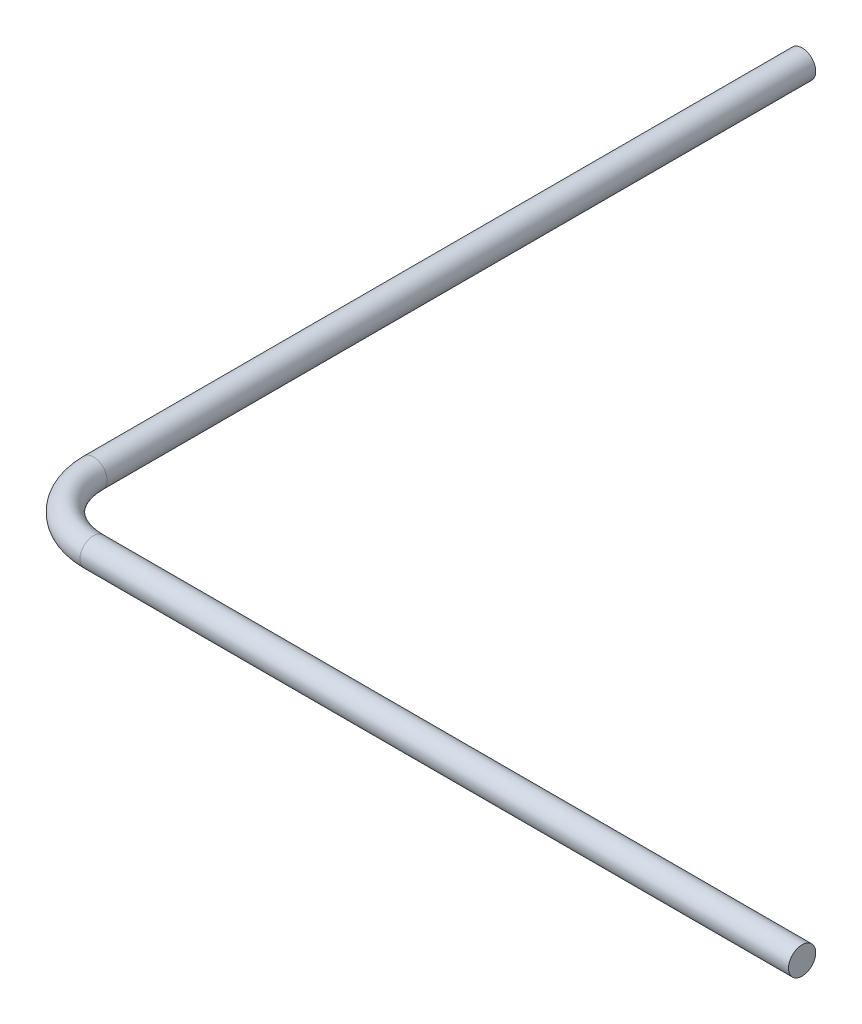
from build123d import *

# Parameters (mm, degrees)
SKETCH_1_R      = 1
EXTRUDE_1_DEPTH = 50
SKETCH_3_R      = 1


with BuildPart() as part:
    # ｽｹｯﾁ1 → ﾎﾞｽ - 押し出し1 (new body)
    with BuildSketch(Plane.XY):
        Circle(SKETCH_1_R)
    extrude(amount=EXTRUDE_1_DEPTH)

    # ｽｲｰﾌﾟ1: sweep along a path in ｽｹｯﾁ2
    with BuildLine(Plane(origin=(0, 0, 0), x_dir=(1, 0, 0), z_dir=(0, 1, 0))) as sweep_1_path:
        Line((0, -50), (0, -52))
        ThreePointArc((0, -52), (1.464466094, -55.535533906), (5, -57))
        Line((5, -57), (57, -57))
    # ｽｹｯﾁ3 → ｽｲｰﾌﾟ1 (sweep)
    with BuildSketch(Plane.XY.offset(50)):
        Circle(SKETCH_3_R)
    sweep(path=sweep_1_path.line)


solid = part.part
